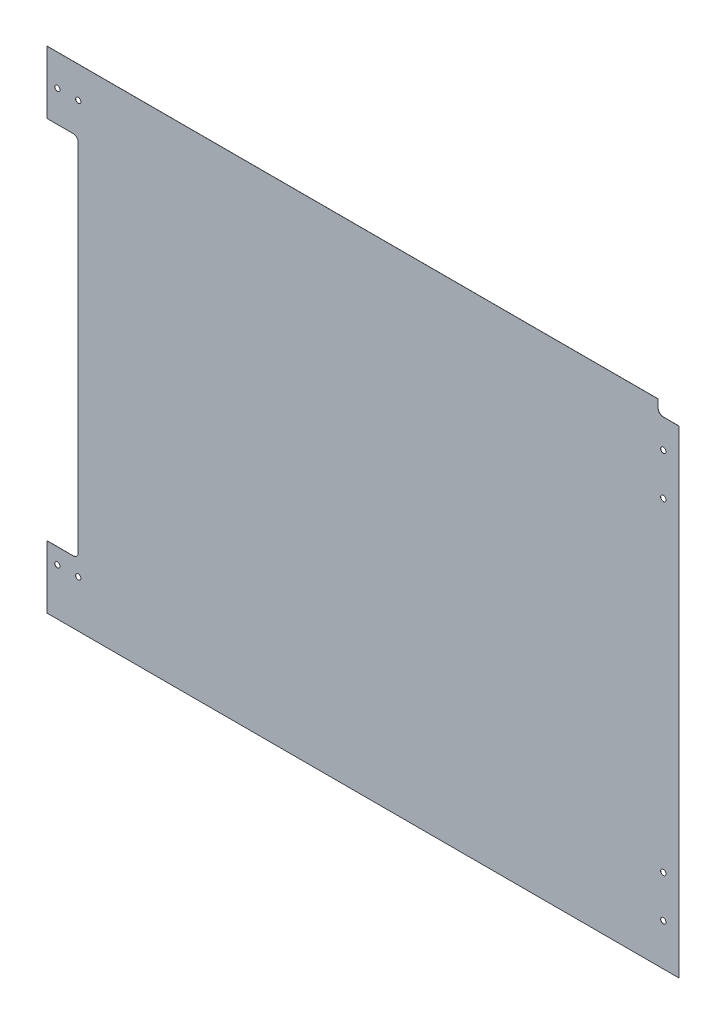
from build123d import *

# Parameters (mm, degrees)
SKETCH1_W                   = 736.6
SKETCH1_H                   = 596.9
BOSS_EXTRUDE1_DEPTH         = 0.127
SKETCH5_W                   = 31.75
SKETCH5_H                   = 76.2
BOSS_EXTRUDE2_DEPTH         = 0.127
SKETCH6_W                   = 6.35
SKETCH6_H                   = 444.5
CUT_EXTRUDE1_DEPTH          = 500.111631931
FILLET1_R                   = 6.35
F_0_257_DIAMETER_HOLE1_D    = 6.5278
F_1_4_0_25_DIAMETER_HOLE2_D = 6.35
CUT_EXTRUDE2_DEPTH          = 500.111631931


with BuildPart() as part:
    # Sketch1 → Boss-Extrude1 (new body)
    with BuildSketch(Plane.XY):
        Rectangle(SKETCH1_W, SKETCH1_H)
    extrude(amount=BOSS_EXTRUDE1_DEPTH)

    # Sketch5 → Boss-Extrude2 (add)
    with BuildSketch(Plane.XY.offset(0.127)):
        with Locations((-384.175, 260.35)):
            Rectangle(SKETCH5_W, SKETCH5_H)
        with Locations((-384.175, -260.35)):
            Rectangle(SKETCH5_W, SKETCH5_H)
    extrude(amount=-BOSS_EXTRUDE2_DEPTH)

    # Sketch6 → Cut-Extrude1 (cut, through all)
    with BuildSketch(Plane.XY.offset(0.127)):
        with Locations((-365.125, 0)):
            Rectangle(SKETCH6_W, SKETCH6_H)
    extrude(amount=-CUT_EXTRUDE1_DEPTH, mode=Mode.SUBTRACT)

    # Fillet1
    fillet1_edges = [part.edges().sort_by_distance(p)[0] for p in [
        (-361.95, 222.25, 0.0635),
        (-361.95, -222.25, 0.0635),
    ]]
    fillet(fillet1_edges, radius=FILLET1_R)

    # F (0.257) Diameter Hole1 (through all)
    with Locations(Plane.XY.offset(0.127)):
        with Locations((349.25, 247.65), (349.25, 196.85), (349.25, -196.85), (349.25, -247.65)):
            Hole(F_0_257_DIAMETER_HOLE1_D / 2)

    # 1/4 (0.25) Diameter Hole2 (through all)
    with Locations(Plane.XY.offset(0.127)):
        with Locations((-387.35, 260.35), (-361.95, 260.35), (-361.95, -241.3), (-387.35, -241.3)):
            Hole(F_1_4_0_25_DIAMETER_HOLE2_D / 2)

    # Sketch13 → Cut-Extrude2 (cut, through all)
    with BuildSketch(Plane.XY.offset(0.127)):
        with BuildLine():
            Line((368.3, 298.45), (342.9, 298.45))
            Line((342.9, 298.45), (342.9, 288.925))
            ThreePointArc((342.9, 288.925), (344.759871939, 284.434871939), (349.25, 282.575))
            Line((349.25, 282.575), (368.3, 282.575))
            Line((368.3, 282.575), (368.3, 298.45))
        make_face()
    extrude(amount=-CUT_EXTRUDE2_DEPTH, mode=Mode.SUBTRACT)


solid = part.part
